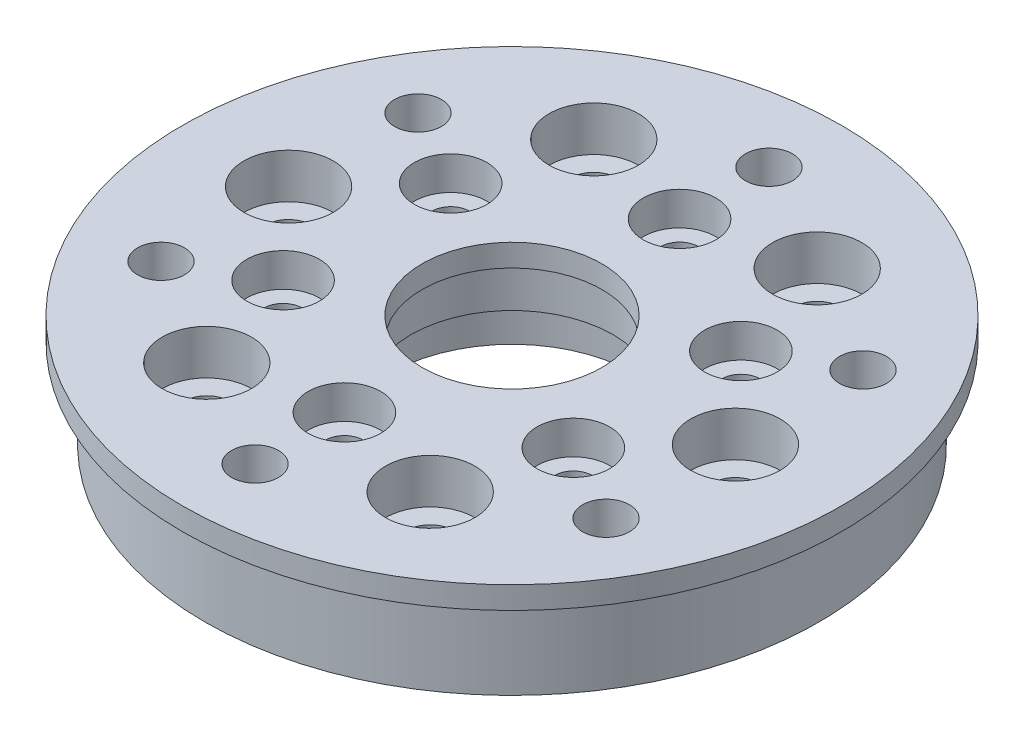
from build123d import *

# Parameters (mm, degrees)
SKETCH1_R                      = 27.5
SKETCH1_R_2                    = 8.05
BOSS_EXTRUDE1_DEPTH            = 10
SKETCH1_4_R                    = 3.05
CUT_EXTRUDE1_DEPTH             = 4
CBORE_FOR_M4_SHCS1_D           = 4.1
CBORE_FOR_M4_SHCS1_CBORE_D     = 8
CBORE_FOR_M4_SHCS1_CBORE_DEPTH = 4
CIRPATTERN1_COUNT              = 6
SKETCH1_5_R                    = 9.05
CUT_EXTRUDE2_DEPTH             = 8
BOSS_EXTRUDE2_START            = 8
SKETCH1_6_R                    = 29.5
SKETCH1_6_R_2                  = 27.5
BOSS_EXTRUDE2_DEPTH            = 2
M5X0_8_TAPPED_HOLE1_D          = 4.2
CBORE_FOR_M3_SHCS1_D           = 3.4
CBORE_FOR_M3_SHCS1_CBORE_D     = 6.5
CBORE_FOR_M3_SHCS1_CBORE_DEPTH = 3
CIRPATTERN2_COUNT              = 6
SKETCH9_R                      = 11
CUT_EXTRUDE3_DEPTH             = 4


with BuildPart() as part:
    # Sketch1 → Boss-Extrude1 (new body)
    with BuildSketch(Plane(origin=(0, 0, 0), x_dir=(1, 0, 0), z_dir=(0, 1, 0))):
        with Locations(Location((0, 0, 0), (0, 0, 270))):
            Circle(SKETCH1_R)
        with Locations(Location((0, 0, 0), (0, 0, 270))):
            Circle(SKETCH1_R_2, mode=Mode.SUBTRACT)
    extrude(amount=BOSS_EXTRUDE1_DEPTH)

    # Sketch1<4> → Cut-Extrude1 (cut)
    with BuildSketch(Plane(origin=(0, 0, 0), x_dir=(1, 0, 0), z_dir=(0, 1, 0))):
        with Locations(Location((-20, 0, 0), (0, 0, 270))):
            Circle(SKETCH1_4_R)
        with Locations(Location((-10, 17.320508076, 0), (0, 0, 270))):
            Circle(SKETCH1_4_R)
        with Locations(Location((10, 17.320508076, 0), (0, 0, 270))):
            Circle(SKETCH1_4_R)
        with Locations(Location((20, 0, 0), (0, 0, 270))):
            Circle(SKETCH1_4_R)
        with Locations(Location((10, -17.320508076, 0), (0, 0, 270))):
            Circle(SKETCH1_4_R)
        with Locations(Location((-10, -17.320508076, 0), (0, 0, 270))):
            Circle(SKETCH1_4_R)
    extrude(amount=CUT_EXTRUDE1_DEPTH, mode=Mode.SUBTRACT)

    # CBORE for M4 SHCS1 (through all)
    with Locations(Plane(origin=(0, 10, 0), x_dir=(1, 0, 0), z_dir=(0, 1, 0))):
        with Locations((-20, 0)):
            cbore_for_m4_shcs1 = CounterBoreHole(CBORE_FOR_M4_SHCS1_D / 2, CBORE_FOR_M4_SHCS1_CBORE_D / 2, CBORE_FOR_M4_SHCS1_CBORE_DEPTH)

    # CirPattern1: CBORE for M4 SHCS1 ×6 about axis
    cirpattern1_axis = Axis((0, 0, 0), (0, 1, 0))
    for i in range(1, CIRPATTERN1_COUNT):
        add(cbore_for_m4_shcs1.rotate(cirpattern1_axis, i * 360 / CIRPATTERN1_COUNT), mode=Mode.SUBTRACT)

    # Sketch1<5> → Cut-Extrude2 (cut)
    with BuildSketch(Plane(origin=(0, 0, 0), x_dir=(1, 0, 0), z_dir=(0, 1, 0))):
        with Locations(Location((0, 0, 0), (0, 0, 270))):
            Circle(SKETCH1_5_R)
    extrude(amount=CUT_EXTRUDE2_DEPTH, mode=Mode.SUBTRACT)

    # Sketch1<6> → Boss-Extrude2 (add)
    with BuildSketch(Plane(origin=(0, 0, 0), x_dir=(1, 0, 0), z_dir=(0, 1, 0)).offset(BOSS_EXTRUDE2_START)):
        with Locations(Location((0, 0, 0), (0, 0, 270))):
            Circle(SKETCH1_6_R)
        with Locations(Location((0, 0, 0), (0, 0, 270))):
            Circle(SKETCH1_6_R_2, mode=Mode.SUBTRACT)
    extrude(amount=BOSS_EXTRUDE2_DEPTH)

    # M5x0.8 Tapped Hole1 (through all)
    with Locations(Plane(origin=(0, 10, 0), x_dir=(1, 0, 0), z_dir=(0, 1, 0))):
        with Locations((0, 23)):
            m5x0_8_tapped_hole1 = Hole(M5X0_8_TAPPED_HOLE1_D / 2)

    # CBORE for M3 SHCS1 (through all)
    with Locations(Plane(origin=(0, 10, 0), x_dir=(1, 0, 0), z_dir=(0, 1, 0))):
        with Locations((0, 15)):
            cbore_for_m3_shcs1 = CounterBoreHole(CBORE_FOR_M3_SHCS1_D / 2, CBORE_FOR_M3_SHCS1_CBORE_D / 2, CBORE_FOR_M3_SHCS1_CBORE_DEPTH)

    # CirPattern2: M5x0.8 Tapped Hole1, CBORE for M3 SHCS1 ×6 about axis
    cirpattern2_axis = Axis((0, 0, 0), (0, 1, 0))
    add([m5x0_8_tapped_hole1.rotate(cirpattern2_axis, i * 360 / CIRPATTERN2_COUNT) for i in range(1, CIRPATTERN2_COUNT)], mode=Mode.SUBTRACT)
    add([cbore_for_m3_shcs1.rotate(cirpattern2_axis, i * 360 / CIRPATTERN2_COUNT) for i in range(1, CIRPATTERN2_COUNT)], mode=Mode.SUBTRACT)

    # Sketch9 → Cut-Extrude3 (cut)
    with BuildSketch(Plane.XZ):
        with Locations(Location((0, 0, 0), (0, 0, 270))):
            Circle(SKETCH9_R)
    extrude(amount=-CUT_EXTRUDE3_DEPTH, mode=Mode.SUBTRACT)


solid = part.part
